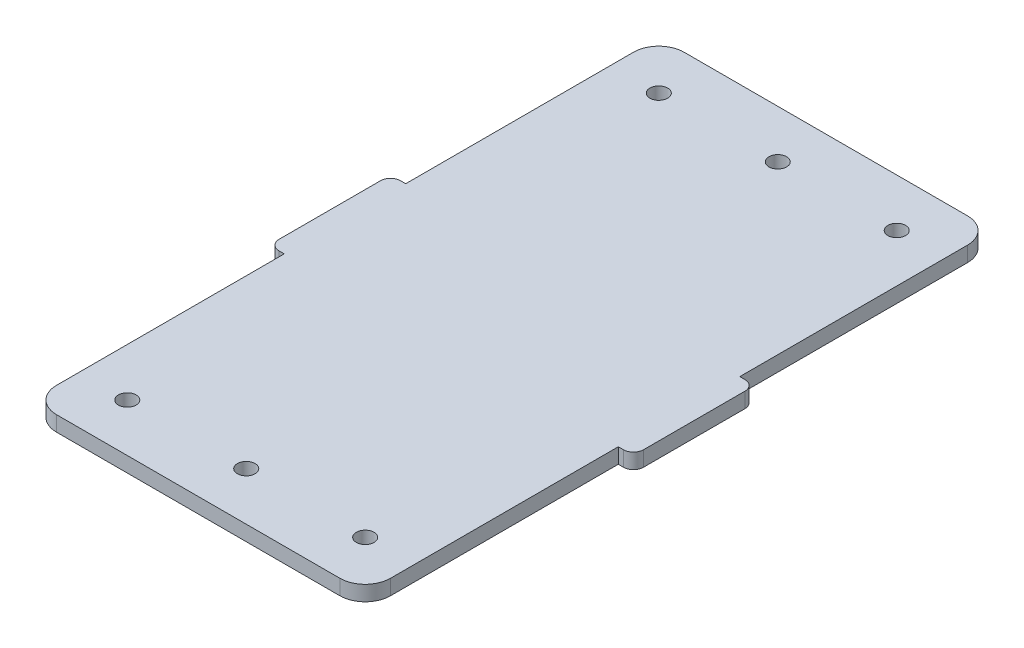
from build123d import *

# Parameters (mm, degrees)
SKETCH_1_W               = 72
SKETCH_1_H               = 100
EXTRUDE_1_DEPTH          = 3
SKETCH_2_W               = 72
SKETCH_2_H               = 3
EXTRUDE_2_DEPTH          = 24
CUT_EXTRUDE_1_DEPTH      = 83.346827504
CUT_EXTRUDE_1_DEPTH_BACK = 83.346827504
SKETCH_3_W               = 3
SKETCH_3_H               = 50
CUT_EXTRUDE_2_DEPTH      = 83.346827504
CUT_EXTRUDE_2_DEPTH_BACK = 83.346827504
SKETCH_5_R               = 1.75
CUT_EXTRUDE_3_DEPTH      = 83.346827504
CUT_EXTRUDE_3_DEPTH_BACK = 83.346827504
SKETCH_6_R               = 1.75
FILLET_1_R               = 5
FILLET_2_R               = 2
CUT_EXTRUDE_5_DEPTH      = 83.346827504
CUT_EXTRUDE_5_DEPTH_BACK = 83.346827504
SKETCH_8_R               = 1.75


with BuildPart() as part:
    # 草图1 → 凸台-拉伸1 (new body)
    with BuildSketch(Plane(origin=(0, 0, 0), x_dir=(1, 0, 0), z_dir=(0, 1, 0))):
        Rectangle(SKETCH_1_W, SKETCH_1_H)
    extrude(amount=EXTRUDE_1_DEPTH)

    # 草图2 → 凸台-拉伸2 (add)
    with BuildSketch(Plane.XY.offset(50)):
        with Locations((0, 1.5)):
            Rectangle(SKETCH_2_W, SKETCH_2_H)
    extrude(amount=EXTRUDE_2_DEPTH)

    # 草图3 → 切除-拉伸1 (cut, two sides: drawn at the far end of the back side and taken through both)
    with BuildSketch(Plane(origin=(0, 3, 0), x_dir=(1, 0, 0), z_dir=(0, 1, 0)).offset(-CUT_EXTRUDE_1_DEPTH_BACK)):
        with Locations((-34.5, 25)):
            Rectangle(SKETCH_3_W, SKETCH_3_H)
        with Locations((34.5, 25)):
            Rectangle(SKETCH_3_W, SKETCH_3_H)
        with Locations((-34.5, -49)):
            Rectangle(SKETCH_3_W, SKETCH_3_H)
        with Locations((34.5, -49)):
            Rectangle(SKETCH_3_W, SKETCH_3_H)
    extrude(amount=CUT_EXTRUDE_1_DEPTH + CUT_EXTRUDE_1_DEPTH_BACK, mode=Mode.SUBTRACT)

    # 草图5 → 切除-拉伸2 (cut, two sides: drawn at the far end of the back side and taken through both)
    with BuildSketch(Plane(origin=(0, 3, 0), x_dir=(1, 0, 0), z_dir=(0, 1, 0)).offset(-CUT_EXTRUDE_2_DEPTH_BACK)):
        with Locations(Location((-23.5, 40.5, 0), (0, 0, 270))):
            Circle(SKETCH_5_R)
    extrude(amount=CUT_EXTRUDE_2_DEPTH + CUT_EXTRUDE_2_DEPTH_BACK, mode=Mode.SUBTRACT)

    # 草图6 → 切除-拉伸3 (cut, two sides: drawn at the far end of the back side and taken through both)
    with BuildSketch(Plane(origin=(0, 3, 0), x_dir=(1, 0, 0), z_dir=(0, 1, 0)).offset(-CUT_EXTRUDE_3_DEPTH_BACK)):
        with Locations(Location((23.5, 40.5, 0), (0, 0, 270))):
            Circle(SKETCH_6_R)
        with Locations(Location((-23.5, -64.5, 0), (0, 0, 270))):
            Circle(SKETCH_6_R)
        with Locations(Location((23.5, -64.5, 0), (0, 0, 270))):
            Circle(SKETCH_6_R)
    extrude(amount=CUT_EXTRUDE_3_DEPTH + CUT_EXTRUDE_3_DEPTH_BACK, mode=Mode.SUBTRACT)

    # 圆角1
    fillet_1_edges = [part.edges().sort_by_distance(p)[0] for p in [
        (33, 1.5, -50),
        (-33, 1.5, 74),
        (33, 1.5, 74),
        (-33, 1.5, -50),
    ]]
    fillet(fillet_1_edges, radius=FILLET_1_R)

    # 圆角2
    fillet_2_edges = [part.edges().sort_by_distance(p)[0] for p in [
        (36, 1.5, 0),
        (-36, 1.5, 24),
        (36, 1.5, 24),
        (-36, 1.5, 0),
    ]]
    fillet(fillet_2_edges, radius=FILLET_2_R)

    # 草图8 → 切除-拉伸5 (cut, two sides: drawn at the far end of the back side and taken through both)
    with BuildSketch(Plane(origin=(0, 3, 0), x_dir=(1, 0, 0), z_dir=(0, 1, 0)).offset(-CUT_EXTRUDE_5_DEPTH_BACK)):
        with Locations(Location((0, 40.5, 0), (0, 0, 270))):
            Circle(SKETCH_8_R)
        with Locations(Location((0, -64.5, 0), (0, 0, 270))):
            Circle(SKETCH_8_R)
    extrude(amount=CUT_EXTRUDE_5_DEPTH + CUT_EXTRUDE_5_DEPTH_BACK, mode=Mode.SUBTRACT)


solid = part.part
